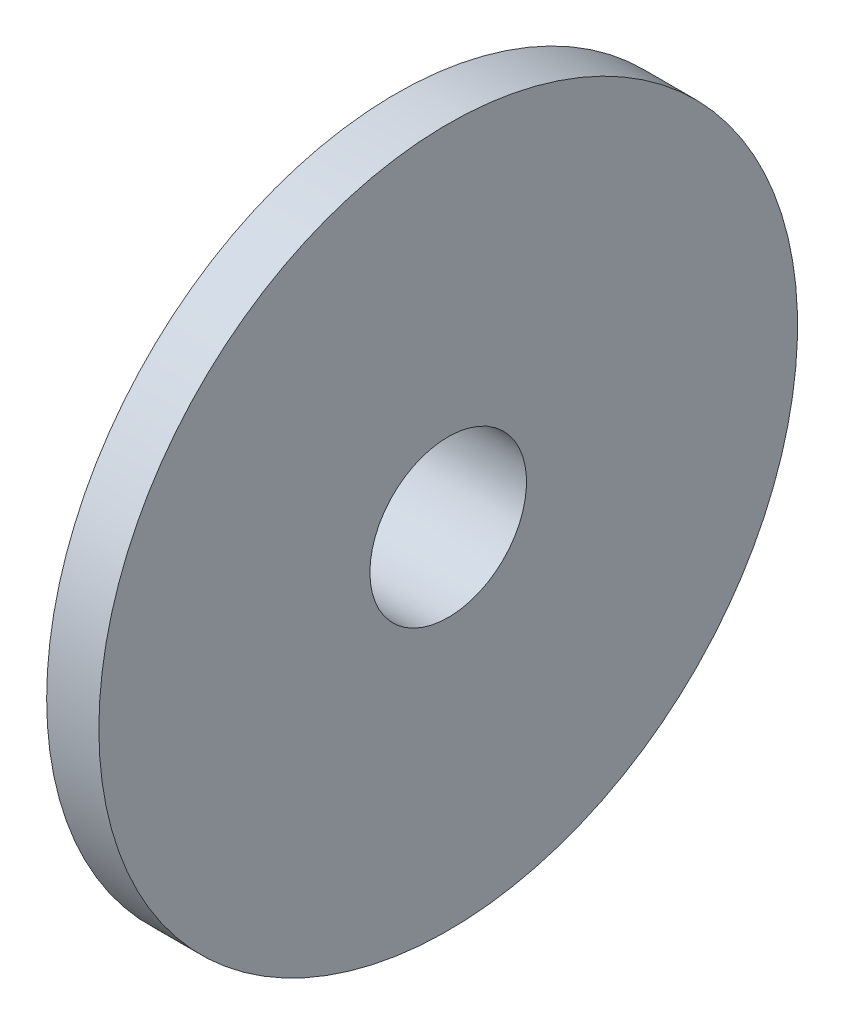
from build123d import *

# Parameters (mm, degrees)
CHAMFER_1_SIZE = 0.2


with BuildPart() as part:
    # 草图1 → 旋转1 (revolve)
    with BuildSketch(Plane.XY, mode=Mode.PRIVATE) as revolve_1_sk:
        Polygon((0, 1.5), (0, 6.692857143), (-1, 6.692857143), (-1, 2.75), (-3, 2.75), (-3, 1.5), align=None)
    revolve(revolve_1_sk.sketch.rotate(Axis((-9.1, 0, 0), (1, 0, 0)), 90), axis=Axis((-9.1, 0, 0), (1, 0, 0)))

    # 倒角1
    chamfer_1_edges = [part.edges().sort_by_distance(p)[0] for p in [
        (-3, 0, -1.5),
        (-3, 0, -2.75),
    ]]
    chamfer(chamfer_1_edges, length=CHAMFER_1_SIZE)


solid = part.part
